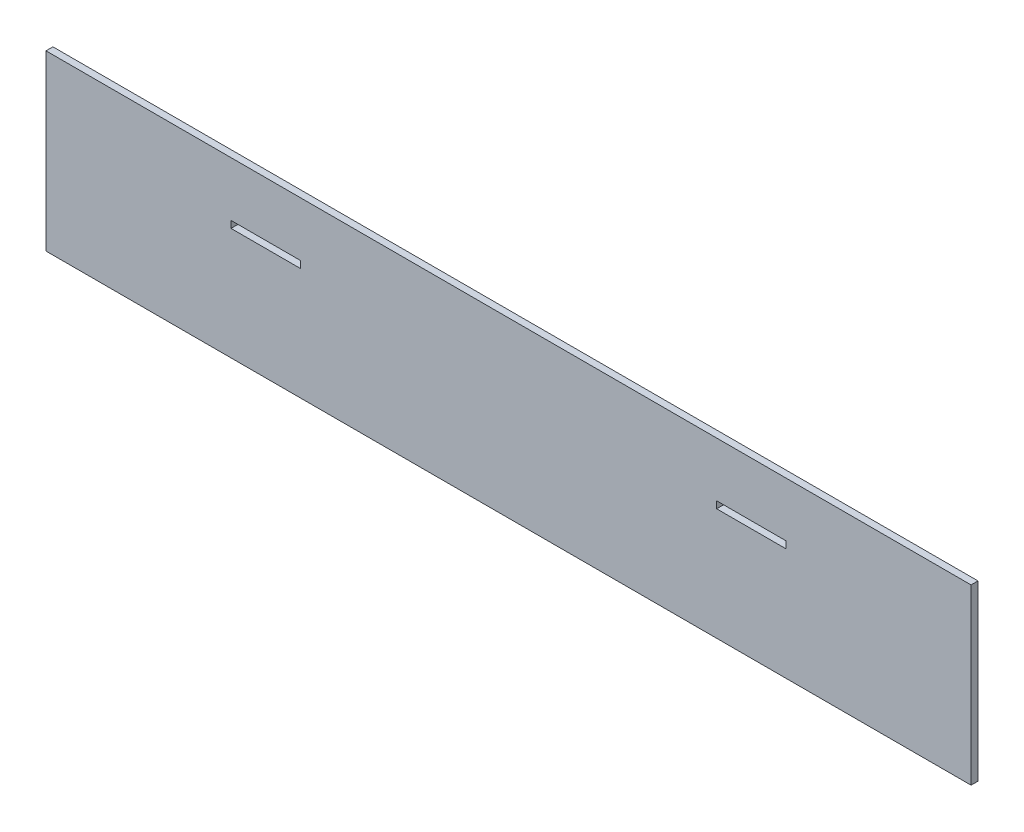
from build123d import *

# Parameters (mm, degrees)
CROQUIS1_W              = 400
CROQUIS1_H              = 75
CROQUIS1_W_2            = 30
CROQUIS1_H_2            = 3
SALIENTE_EXTRUIR1_DEPTH = 3


with BuildPart() as part:
    # Croquis1 → Saliente-Extruir1 (new body)
    with BuildSketch(Plane.XY):
        Rectangle(CROQUIS1_W, CROQUIS1_H)
        with Locations((-105, 12.5)):
            Rectangle(CROQUIS1_W_2, CROQUIS1_H_2, mode=Mode.SUBTRACT)
        with Locations((105, 12.5)):
            Rectangle(CROQUIS1_W_2, CROQUIS1_H_2, mode=Mode.SUBTRACT)
    extrude(amount=SALIENTE_EXTRUIR1_DEPTH)


solid = part.part
